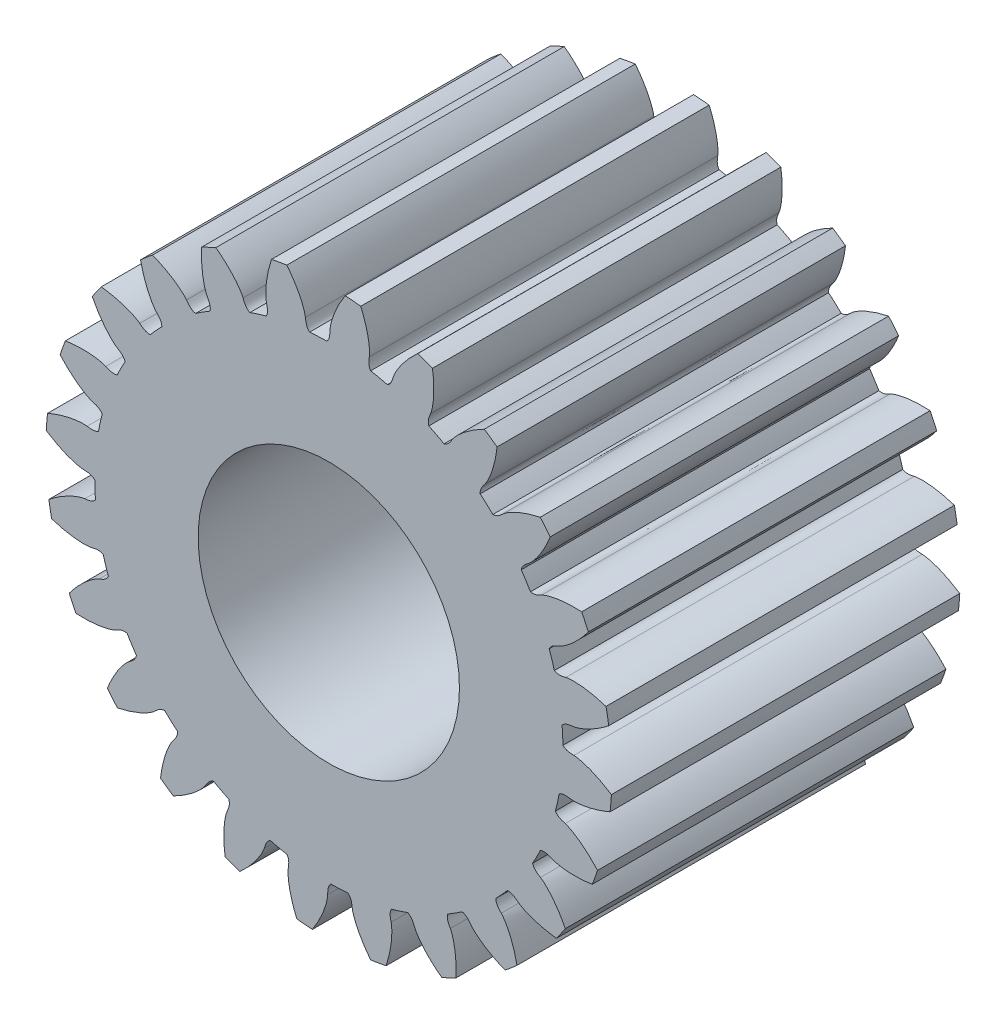
from build123d import *

# Parameters (mm, degrees)
EXTRUDE_1_DEPTH     = 8
SKETCH_4_R          = 3
CUT_EXTRUDE_1_DEPTH = 13.174471066


with BuildPart() as part:
    # 草图3 → 凸台-拉伸1 (new body)
    with BuildSketch(Plane.XY):
        with BuildLine():
            ThreePointArc((1.345300657, 5.203920747), (1.153835674, 5.249694109), (0.96082293, 5.288425503))
            add(Edge.make_bspline(
                [(0.930760994, 5.550248175), (0.917226783, 5.459893705), (0.905381381, 5.370037023), (0.96082293, 5.288425503)],
                knots=[0, 0, 0, 0, 1, 1, 1, 1], degree=3))
            add(Edge.make_bspline(
                [(0.930760994, 5.550248175), (0.931438306, 5.554769911), (0.933027207, 5.567494523), (0.934801806, 5.591702201), (0.935941865, 5.631320511), (0.934813459, 5.681900451), (0.930389457, 5.747252032), (0.921372989, 5.824078989), (0.907490474, 5.908178324), (0.888125137, 5.999148936), (0.865057443, 6.089311483), (0.838587684, 6.178580494), (0.809115965, 6.266822975), (0.779021032, 6.347910467), (0.755476896, 6.406477179), (0.739983442, 6.443220751), (0.733420318, 6.458490121)],
                knots=[0, 0, 0, 0, 0, 0.005376748, 0.015083688, 0.02853182, 0.046610139, 0.064854849, 0.092110525, 0.119476175, 0.146842495, 0.174208853, 0.201574955, 0.228941013, 0.256307345, 0.275859483, 0.275859483, 0.275859483, 0.275859483, 0.275859483], degree=4))
            ThreePointArc((0.733420318, 6.458490121), (0.55475765, 6.476283189), (0.3756717, 6.489134825))
            add(Edge.make_bspline(
                [(0.026739495, 5.627686544), (0.02684107, 5.632257597), (0.027439416, 5.64506706), (0.029807716, 5.669223882), (0.035422228, 5.708458911), (0.045136421, 5.758110074), (0.060610441, 5.821757192), (0.082561661, 5.895931459), (0.110544865, 5.976444581), (0.145099627, 6.062796402), (0.183165379, 6.147722263), (0.224431669, 6.231189009), (0.2684816, 6.313133632), (0.311928808, 6.387921517), (0.345090501, 6.441630818), (0.366607295, 6.475204102), (0.3756717, 6.489134825)],
                knots=[0, 0, 0, 0, 0, 0.005376748, 0.015083688, 0.02853182, 0.046610139, 0.064854849, 0.092110525, 0.119476175, 0.146842495, 0.174208853, 0.201574955, 0.228941013, 0.256307345, 0.275859491, 0.275859491, 0.275859491, 0.275859491, 0.275859491], degree=4))
            add(Edge.make_bspline(
                [(0.026739495, 5.627686544), (0.024709785, 5.5363466), (0.021100528, 5.44578441), (-0.04741315, 5.374790879)],
                knots=[0, 0, 0, 0, 1, 1, 1, 1], degree=3))
            ThreePointArc((-0.04741315, 5.374790879), (-0.244201139, 5.369449767), (-0.440661556, 5.356906047))
            add(Edge.make_bspline(
                [(-0.537463851, 5.602026727), (-0.527151437, 5.511248099), (-0.515336595, 5.421387393), (-0.440661556, 5.356906047)],
                knots=[0, 0, 0, 0, 1, 1, 1, 1], degree=3))
            add(Edge.make_bspline(
                [(-0.537463851, 5.602026727), (-0.537979929, 5.606569689), (-0.53973854, 5.619271959), (-0.544289818, 5.64311408), (-0.553442579, 5.681677498), (-0.567623586, 5.730241915), (-0.588811078, 5.792221679), (-0.617404597, 5.864097187), (-0.652580586, 5.941737847), (-0.694830993, 6.024596593), (-0.740448458, 6.105716567), (-0.789120802, 6.185092933), (-0.840427131, 6.262700782), (-0.890483591, 6.333236142), (-0.928383661, 6.383713571), (-0.952859125, 6.415195136), (-0.963150619, 6.428245553)],
                knots=[0, 0, 0, 0, 0, 0.005376748, 0.015083688, 0.02853182, 0.046610139, 0.064854849, 0.092110525, 0.119476175, 0.146842495, 0.174208853, 0.201574955, 0.228941013, 0.256307345, 0.275859483, 0.275859483, 0.275859483, 0.275859483, 0.275859483], degree=4))
            ThreePointArc((-0.963150619, 6.428245553), (-1.140330689, 6.399191036), (-1.316640682, 6.365253908))
            add(Edge.make_bspline(
                [(-1.430724089, 5.442848465), (-1.43180905, 5.447290054), (-1.434546426, 5.459817908), (-1.438511069, 5.483764567), (-1.44324264, 5.523115837), (-1.446710116, 5.573589396), (-1.448236447, 5.639072763), (-1.44623091, 5.716400997), (-1.440039539, 5.801413287), (-1.429011698, 5.893766171), (-1.414223436, 5.985650395), (-1.395966044, 6.076953583), (-1.374625907, 6.167506972), (-1.352015655, 6.250991485), (-1.333884909, 6.311453565), (-1.321790688, 6.349451822), (-1.316640682, 6.365253908)],
                knots=[0, 0, 0, 0, 0, 0.005376748, 0.015083688, 0.02853182, 0.046610139, 0.064854849, 0.092110525, 0.119476175, 0.146842495, 0.174208853, 0.201574955, 0.228941013, 0.256307345, 0.275859491, 0.275859491, 0.275859491, 0.275859491, 0.275859491], degree=4))
            add(Edge.make_bspline(
                [(-1.430724089, 5.442848465), (-1.409044121, 5.354095527), (-1.389091176, 5.265685024), (-1.436895829, 5.179377895)],
                knots=[0, 0, 0, 0, 1, 1, 1, 1], degree=3))
            ThreePointArc((-1.436895829, 5.179377895), (-1.625596049, 5.123286298), (-1.812115686, 5.060322296))
            add(Edge.make_bspline(
                [(-1.969061422, 5.272036414), (-1.935605158, 5.187020042), (-1.900935235, 5.103279172), (-1.812115686, 5.060322296)],
                knots=[0, 0, 0, 0, 1, 1, 1, 1], degree=3))
            add(Edge.make_bspline(
                [(-1.969061422, 5.272036414), (-1.970735721, 5.276291008), (-1.975721998, 5.288105296), (-1.986288989, 5.30995706), (-2.005110825, 5.344837552), (-2.031378022, 5.388076862), (-2.067885111, 5.44246099), (-2.11410708, 5.504486852), (-2.168179358, 5.570377756), (-2.230435538, 5.639477948), (-2.29549402, 5.706027157), (-2.36305201, 5.770101509), (-2.432696507, 5.83178588), (-2.49930323, 5.886962241), (-2.548976406, 5.925910433), (-2.580765916, 5.949984573), (-2.594084433, 5.959926674)],
                knots=[0, 0, 0, 0, 0, 0.005376748, 0.015083688, 0.02853182, 0.046610139, 0.064854849, 0.092110525, 0.119476175, 0.146842495, 0.174208853, 0.201574955, 0.228941013, 0.256307345, 0.275859483, 0.275859483, 0.275859483, 0.275859483, 0.275859483], degree=4))
            ThreePointArc((-2.594084433, 5.959926674), (-2.757707377, 5.886004589), (-2.919226177, 5.807591457))
            add(Edge.make_bspline(
                [(-2.79068619, 4.887089259), (-2.79288375, 4.891098695), (-2.798770299, 4.902491188), (-2.808797701, 4.924595759), (-2.823552906, 4.961381547), (-2.83996575, 5.009237812), (-2.858388415, 5.072094843), (-2.876465234, 5.147307253), (-2.892487629, 5.231025264), (-2.905738238, 5.323085515), (-2.91523526, 5.415666344), (-2.921230978, 5.508583812), (-2.92405493, 5.601574903), (-2.923822486, 5.688066715), (-2.921958268, 5.751161181), (-2.92011082, 5.790994894), (-2.919226177, 5.807591457)],
                knots=[0, 0, 0, 0, 0, 0.005376748, 0.015083688, 0.02853182, 0.046610139, 0.064854849, 0.092110525, 0.119476175, 0.146842495, 0.174208853, 0.201574955, 0.228941013, 0.256307345, 0.275859491, 0.275859491, 0.275859491, 0.275859491, 0.275859491], degree=4))
            add(Edge.make_bspline(
                [(-2.79068619, 4.887089259), (-2.746773999, 4.806971692), (-2.704618611, 4.726737907), (-2.728456432, 4.630998866)],
                knots=[0, 0, 0, 0, 1, 1, 1, 1], degree=3))
            ThreePointArc((-2.728456432, 4.630998866), (-2.896209274, 4.527979333), (-3.060077126, 4.418885944))
            add(Edge.make_bspline(
                [(-3.266470712, 4.582765533), (-3.212150585, 4.509305142), (-3.15698828, 4.437390908), (-3.060077126, 4.418885944)],
                knots=[0, 0, 0, 0, 1, 1, 1, 1], degree=3))
            add(Edge.make_bspline(
                [(-3.266470712, 4.582765533), (-3.26918913, 4.586441815), (-3.277063266, 4.596562997), (-3.292925849, 4.614935241), (-3.320134081, 4.64375576), (-3.356697403, 4.678723275), (-3.406036191, 4.721805579), (-3.466736659, 4.769754836), (-3.53602029, 4.819405625), (-3.614039588, 4.870038201), (-3.694105458, 4.917481427), (-3.775945128, 4.961887203), (-3.859181637, 5.003444408), (-3.937799483, 5.039501592), (-3.99586062, 5.064266293), (-4.032797776, 5.079292395), (-4.04823568, 5.085448641)],
                knots=[0, 0, 0, 0, 0, 0.005376748, 0.015083688, 0.02853182, 0.046610139, 0.064854849, 0.092110525, 0.119476175, 0.146842495, 0.174208853, 0.201574955, 0.228941013, 0.256307345, 0.275859483, 0.275859483, 0.275859483, 0.275859483, 0.275859483], degree=4))
            ThreePointArc((-4.04823568, 5.085448641), (-4.187150864, 4.971696656), (-4.322871232, 4.854151245))
            add(Edge.make_bspline(
                [(-3.96046764, 3.998282996), (-3.963628038, 4.001587043), (-3.972262602, 4.011067795), (-3.987669413, 4.029823889), (-4.011442708, 4.061537303), (-4.039682411, 4.103514949), (-4.073745935, 4.159462043), (-4.110673206, 4.227433027), (-4.147817467, 4.304151514), (-4.184443518, 4.389645379), (-4.21757862, 4.476613582), (-4.247418848, 4.564813159), (-4.274214442, 4.653904762), (-4.296375647, 4.737509598), (-4.310905, 4.798936667), (-4.319430226, 4.837891234), (-4.322871232, 4.854151245)],
                knots=[0, 0, 0, 0, 0, 0.005376748, 0.015083688, 0.02853182, 0.046610139, 0.064854849, 0.092110525, 0.119476175, 0.146842495, 0.174208853, 0.201574955, 0.228941013, 0.256307345, 0.275859491, 0.275859491, 0.275859491, 0.275859491, 0.275859491], degree=4))
            add(Edge.make_bspline(
                [(-3.96046764, 3.998282996), (-3.897315767, 3.93226068), (-3.835830758, 3.865671412), (-3.834077238, 3.767024918)],
                knots=[0, 0, 0, 0, 1, 1, 1, 1], degree=3))
            ThreePointArc((-3.834077238, 3.767024918), (-3.969450623, 3.62409806), (-4.099499366, 3.476309817))
            add(Edge.make_bspline(
                [(-4.34127542, 3.581186753), (-4.269793259, 3.524288548), (-4.19789779, 3.469101788), (-4.099499366, 3.476309817)],
                knots=[0, 0, 0, 0, 1, 1, 1, 1], degree=3))
            add(Edge.make_bspline(
                [(-4.34127542, 3.581186753), (-4.344852702, 3.584034191), (-4.355078089, 3.591772526), (-4.375155254, 3.605413212), (-4.408895687, 3.626209687), (-4.453263403, 3.650522429), (-4.512071533, 3.679366921), (-4.583113863, 3.709971909), (-4.662887282, 3.739998966), (-4.751352812, 3.768713398), (-4.840969714, 3.793817463), (-4.931513825, 3.815528484), (-5.022669915, 3.834126468), (-5.107941209, 3.848607237), (-5.170433538, 3.857500773), (-5.210001131, 3.862454835), (-5.226506355, 3.864405687)],
                knots=[0, 0, 0, 0, 0, 0.005376748, 0.015083688, 0.02853182, 0.046610139, 0.064854849, 0.092110525, 0.119476175, 0.146842495, 0.174208853, 0.201574955, 0.228941013, 0.256307345, 0.275859483, 0.275859483, 0.275859483, 0.275859483, 0.275859483], degree=4))
            ThreePointArc((-5.226506355, 3.864405687), (-5.331246939, 3.718575813), (-5.431919757, 3.569908648))
            add(Edge.make_bspline(
                [(-4.860349764, 2.837000354), (-4.864257625, 2.839373847), (-4.875051772, 2.846296761), (-4.894788043, 2.86042618), (-4.925959319, 2.884906004), (-4.964101391, 2.918144324), (-5.011484403, 2.963368777), (-5.064745592, 3.019466225), (-5.120480399, 3.083956952), (-5.177985888, 3.157058164), (-5.232500966, 3.232487002), (-5.284152144, 3.309958031), (-5.333093303, 3.389078702), (-5.376137907, 3.46409903), (-5.40607068, 3.51967255), (-5.424387599, 3.555093281), (-5.431919757, 3.569908648)],
                knots=[0, 0, 0, 0, 0, 0.005376748, 0.015083688, 0.02853182, 0.046610139, 0.064854849, 0.092110525, 0.119476175, 0.146842495, 0.174208853, 0.201574955, 0.228941013, 0.256307345, 0.275859491, 0.275859491, 0.275859491, 0.275859491, 0.275859491], degree=4))
            add(Edge.make_bspline(
                [(-4.860349764, 2.837000354), (-4.782261907, 2.789572601), (-4.705637378, 2.741165798), (-4.678412016, 2.646334447)],
                knots=[0, 0, 0, 0, 1, 1, 1, 1], degree=3))
            ThreePointArc((-4.678412016, 2.646334447), (-4.772180472, 2.473240493), (-4.8595475, 2.296828921))
            add(Edge.make_bspline(
                [(-5.120229383, 2.335556015), (-5.036456579, 2.299097513), (-4.952727504, 2.264399113), (-4.8595475, 2.296828921)],
                knots=[0, 0, 0, 0, 1, 1, 1, 1], degree=3))
            add(Edge.make_bspline(
                [(-5.120229383, 2.335556015), (-5.124421743, 2.337380559), (-5.136301537, 2.342208692), (-5.159225058, 2.350188231), (-5.197198338, 2.361543416), (-5.246346861, 2.373544512), (-5.310616657, 2.386185488), (-5.387159432, 2.397360528), (-5.471986212, 2.405717558), (-5.564869194, 2.410557006), (-5.657929884, 2.411611109), (-5.751008006, 2.409147805), (-5.843871539, 2.403519145), (-5.929985183, 2.395436659), (-5.992649954, 2.387852951), (-6.03215152, 2.38239736), (-6.04859926, 2.380009873)],
                knots=[0, 0, 0, 0, 0, 0.005376748, 0.015083688, 0.02853182, 0.046610139, 0.064854849, 0.092110525, 0.119476175, 0.146842495, 0.174208853, 0.201574955, 0.228941013, 0.256307345, 0.275859483, 0.275859483, 0.275859483, 0.275859483, 0.275859483], degree=4))
            ThreePointArc((-6.04859926, 2.380009873), (-6.112027346, 2.212040172), (-6.170791927, 2.042382676))
            add(Edge.make_bspline(
                [(-5.429007085, 1.482380826), (-5.433396093, 1.483662016), (-5.445614221, 1.487555306), (-5.468334958, 1.496095154), (-5.504779943, 1.511673129), (-5.550225066, 1.533906986), (-5.60769849, 1.565326827), (-5.673663936, 1.605727791), (-5.744191054, 1.65359582), (-5.818657077, 1.709322653), (-5.890837018, 1.768071775), (-5.960779203, 1.829534735), (-6.028530669, 1.89329253), (-6.089525253, 1.954615839), (-6.132821577, 2.000548565), (-6.159681922, 2.030021597), (-6.170791927, 2.042382676)],
                knots=[0, 0, 0, 0, 0, 0.005376748, 0.015083688, 0.02853182, 0.046610139, 0.064854849, 0.092110525, 0.119476175, 0.146842495, 0.174208853, 0.201574955, 0.228941013, 0.256307345, 0.275859491, 0.275859491, 0.275859491, 0.275859491, 0.275859491], degree=4))
            add(Edge.make_bspline(
                [(-5.429007085, 1.482380826), (-5.341304801, 1.45677976), (-5.254762587, 1.429854266), (-5.203920747, 1.345300657)],
                knots=[0, 0, 0, 0, 1, 1, 1, 1], degree=3))
            ThreePointArc((-5.203920747, 1.345300657), (-5.249694109, 1.153835674), (-5.288425503, 0.96082293))
            add(Edge.make_bspline(
                [(-5.550248175, 0.930760994), (-5.459893705, 0.917226783), (-5.370037023, 0.905381382), (-5.288425503, 0.96082293)],
                knots=[0, 0, 0, 0, 1, 1, 1, 1], degree=3))
            add(Edge.make_bspline(
                [(-5.550248175, 0.930760994), (-5.554769911, 0.931438306), (-5.567494523, 0.933027207), (-5.591702201, 0.934801806), (-5.631320511, 0.935941865), (-5.681900451, 0.934813459), (-5.747252032, 0.930389457), (-5.824078989, 0.921372989), (-5.908178324, 0.907490474), (-5.999148936, 0.888125137), (-6.089311483, 0.865057443), (-6.178580494, 0.838587684), (-6.266822975, 0.809115965), (-6.347910467, 0.779021032), (-6.406477179, 0.755476896), (-6.443220751, 0.739983442), (-6.458490121, 0.733420318)],
                knots=[0, 0, 0, 0, 0, 0.005376748, 0.015083688, 0.02853182, 0.046610139, 0.064854849, 0.092110525, 0.119476175, 0.146842495, 0.174208853, 0.201574955, 0.228941013, 0.256307345, 0.275859483, 0.275859483, 0.275859483, 0.275859483, 0.275859483], degree=4))
            ThreePointArc((-6.458490121, 0.733420318), (-6.476283189, 0.55475765), (-6.489134825, 0.3756717))
            add(Edge.make_bspline(
                [(-5.627686544, 0.026739495), (-5.632257597, 0.02684107), (-5.64506706, 0.027439416), (-5.669223882, 0.029807716), (-5.708458911, 0.035422228), (-5.758110074, 0.045136421), (-5.821757192, 0.060610441), (-5.895931459, 0.082561661), (-5.976444581, 0.110544865), (-6.062796402, 0.145099627), (-6.147722263, 0.183165379), (-6.231189009, 0.224431669), (-6.313133632, 0.2684816), (-6.387921517, 0.311928808), (-6.441630818, 0.345090501), (-6.475204102, 0.366607295), (-6.489134825, 0.3756717)],
                knots=[0, 0, 0, 0, 0, 0.005376748, 0.015083688, 0.02853182, 0.046610139, 0.064854849, 0.092110525, 0.119476175, 0.146842495, 0.174208853, 0.201574955, 0.228941013, 0.256307345, 0.275859491, 0.275859491, 0.275859491, 0.275859491, 0.275859491], degree=4))
            add(Edge.make_bspline(
                [(-5.627686544, 0.026739495), (-5.5363466, 0.024709785), (-5.44578441, 0.021100528), (-5.374790879, -0.04741315)],
                knots=[0, 0, 0, 0, 1, 1, 1, 1], degree=3))
            ThreePointArc((-5.374790879, -0.04741315), (-5.369449767, -0.244201139), (-5.356906047, -0.440661556))
            add(Edge.make_bspline(
                [(-5.602026727, -0.537463851), (-5.511248099, -0.527151437), (-5.421387393, -0.515336595), (-5.356906047, -0.440661556)],
                knots=[0, 0, 0, 0, 1, 1, 1, 1], degree=3))
            add(Edge.make_bspline(
                [(-5.602026727, -0.537463851), (-5.606569689, -0.537979929), (-5.619271959, -0.53973854), (-5.64311408, -0.544289818), (-5.681677498, -0.553442579), (-5.730241915, -0.567623586), (-5.792221679, -0.588811078), (-5.864097187, -0.617404597), (-5.941737847, -0.652580586), (-6.024596593, -0.694830993), (-6.105716567, -0.740448458), (-6.185092933, -0.789120802), (-6.262700782, -0.840427131), (-6.333236142, -0.890483591), (-6.383713571, -0.928383661), (-6.415195136, -0.952859125), (-6.428245553, -0.963150619)],
                knots=[0, 0, 0, 0, 0, 0.005376748, 0.015083688, 0.02853182, 0.046610139, 0.064854849, 0.092110525, 0.119476175, 0.146842495, 0.174208853, 0.201574955, 0.228941013, 0.256307345, 0.275859483, 0.275859483, 0.275859483, 0.275859483, 0.275859483], degree=4))
            ThreePointArc((-6.428245553, -0.963150619), (-6.399191036, -1.140330689), (-6.365253908, -1.316640682))
            add(Edge.make_bspline(
                [(-5.442848465, -1.430724089), (-5.447290054, -1.43180905), (-5.459817908, -1.434546426), (-5.483764567, -1.438511069), (-5.523115837, -1.44324264), (-5.573589396, -1.446710116), (-5.639072763, -1.448236447), (-5.716400997, -1.44623091), (-5.801413287, -1.440039539), (-5.893766171, -1.429011698), (-5.985650395, -1.414223436), (-6.076953583, -1.395966044), (-6.167506972, -1.374625907), (-6.250991485, -1.352015655), (-6.311453565, -1.333884909), (-6.349451822, -1.321790688), (-6.365253908, -1.316640682)],
                knots=[0, 0, 0, 0, 0, 0.005376748, 0.015083688, 0.02853182, 0.046610139, 0.064854849, 0.092110525, 0.119476175, 0.146842495, 0.174208853, 0.201574955, 0.228941013, 0.256307345, 0.275859491, 0.275859491, 0.275859491, 0.275859491, 0.275859491], degree=4))
            add(Edge.make_bspline(
                [(-5.442848465, -1.430724089), (-5.354095527, -1.409044121), (-5.265685024, -1.389091176), (-5.179377895, -1.436895829)],
                knots=[0, 0, 0, 0, 1, 1, 1, 1], degree=3))
            ThreePointArc((-5.179377895, -1.436895829), (-5.123286298, -1.625596049), (-5.060322296, -1.812115686))
            add(Edge.make_bspline(
                [(-5.272036414, -1.969061422), (-5.187020042, -1.935605158), (-5.103279172, -1.900935235), (-5.060322296, -1.812115686)],
                knots=[0, 0, 0, 0, 1, 1, 1, 1], degree=3))
            add(Edge.make_bspline(
                [(-5.272036414, -1.969061422), (-5.276291008, -1.970735721), (-5.288105296, -1.975721998), (-5.30995706, -1.986288989), (-5.344837552, -2.005110825), (-5.388076862, -2.031378022), (-5.44246099, -2.067885111), (-5.504486852, -2.11410708), (-5.570377756, -2.168179358), (-5.639477948, -2.230435538), (-5.706027157, -2.29549402), (-5.770101509, -2.36305201), (-5.83178588, -2.432696507), (-5.886962241, -2.49930323), (-5.925910433, -2.548976406), (-5.949984573, -2.580765916), (-5.959926674, -2.594084433)],
                knots=[0, 0, 0, 0, 0, 0.005376748, 0.015083688, 0.02853182, 0.046610139, 0.064854849, 0.092110525, 0.119476175, 0.146842495, 0.174208853, 0.201574955, 0.228941013, 0.256307345, 0.275859483, 0.275859483, 0.275859483, 0.275859483, 0.275859483], degree=4))
            ThreePointArc((-5.959926674, -2.594084433), (-5.886004589, -2.757707377), (-5.807591457, -2.919226177))
            add(Edge.make_bspline(
                [(-4.887089259, -2.79068619), (-4.891098695, -2.79288375), (-4.902491188, -2.798770299), (-4.924595759, -2.808797701), (-4.961381547, -2.823552906), (-5.009237812, -2.83996575), (-5.072094843, -2.858388415), (-5.147307253, -2.876465234), (-5.231025264, -2.892487629), (-5.323085515, -2.905738238), (-5.415666344, -2.91523526), (-5.508583812, -2.921230978), (-5.601574903, -2.92405493), (-5.688066715, -2.923822486), (-5.751161181, -2.921958268), (-5.790994894, -2.92011082), (-5.807591457, -2.919226177)],
                knots=[0, 0, 0, 0, 0, 0.005376748, 0.015083688, 0.02853182, 0.046610139, 0.064854849, 0.092110525, 0.119476175, 0.146842495, 0.174208853, 0.201574955, 0.228941013, 0.256307345, 0.275859491, 0.275859491, 0.275859491, 0.275859491, 0.275859491], degree=4))
            add(Edge.make_bspline(
                [(-4.887089259, -2.79068619), (-4.806971692, -2.746773999), (-4.726737907, -2.704618611), (-4.630998866, -2.728456432)],
                knots=[0, 0, 0, 0, 1, 1, 1, 1], degree=3))
            ThreePointArc((-4.630998866, -2.728456432), (-4.527979333, -2.896209274), (-4.418885944, -3.060077126))
            add(Edge.make_bspline(
                [(-4.582765533, -3.266470712), (-4.509305142, -3.212150586), (-4.437390908, -3.15698828), (-4.418885944, -3.060077126)],
                knots=[0, 0, 0, 0, 1, 1, 1, 1], degree=3))
            add(Edge.make_bspline(
                [(-4.582765533, -3.266470712), (-4.586441815, -3.26918913), (-4.596562997, -3.277063266), (-4.614935241, -3.292925849), (-4.64375576, -3.320134081), (-4.678723275, -3.356697403), (-4.721805579, -3.406036191), (-4.769754836, -3.466736659), (-4.819405625, -3.53602029), (-4.870038201, -3.614039588), (-4.917481427, -3.694105458), (-4.961887203, -3.775945128), (-5.003444408, -3.859181637), (-5.039501592, -3.937799483), (-5.064266293, -3.99586062), (-5.079292395, -4.032797776), (-5.085448641, -4.04823568)],
                knots=[0, 0, 0, 0, 0, 0.005376748, 0.015083688, 0.02853182, 0.046610139, 0.064854849, 0.092110525, 0.119476175, 0.146842495, 0.174208853, 0.201574955, 0.228941013, 0.256307345, 0.275859483, 0.275859483, 0.275859483, 0.275859483, 0.275859483], degree=4))
            ThreePointArc((-5.085448641, -4.04823568), (-4.971696656, -4.187150864), (-4.854151245, -4.322871232))
            add(Edge.make_bspline(
                [(-3.998282996, -3.96046764), (-4.001587043, -3.963628038), (-4.011067795, -3.972262602), (-4.029823889, -3.987669413), (-4.061537303, -4.011442708), (-4.103514949, -4.039682411), (-4.159462043, -4.073745935), (-4.227433027, -4.110673206), (-4.304151514, -4.147817467), (-4.389645379, -4.184443518), (-4.476613582, -4.21757862), (-4.564813159, -4.247418848), (-4.653904762, -4.274214442), (-4.737509598, -4.296375647), (-4.798936667, -4.310905), (-4.837891234, -4.319430226), (-4.854151245, -4.322871232)],
                knots=[0, 0, 0, 0, 0, 0.005376748, 0.015083688, 0.02853182, 0.046610139, 0.064854849, 0.092110525, 0.119476175, 0.146842495, 0.174208853, 0.201574955, 0.228941013, 0.256307345, 0.275859491, 0.275859491, 0.275859491, 0.275859491, 0.275859491], degree=4))
            add(Edge.make_bspline(
                [(-3.998282996, -3.96046764), (-3.93226068, -3.897315767), (-3.865671412, -3.835830758), (-3.767024918, -3.834077238)],
                knots=[0, 0, 0, 0, 1, 1, 1, 1], degree=3))
            ThreePointArc((-3.767024918, -3.834077238), (-3.62409806, -3.969450623), (-3.476309817, -4.099499366))
            add(Edge.make_bspline(
                [(-3.581186753, -4.34127542), (-3.524288548, -4.269793259), (-3.469101788, -4.19789779), (-3.476309817, -4.099499366)],
                knots=[0, 0, 0, 0, 1, 1, 1, 1], degree=3))
            add(Edge.make_bspline(
                [(-3.581186753, -4.34127542), (-3.584034191, -4.344852702), (-3.591772526, -4.355078089), (-3.605413212, -4.375155254), (-3.626209687, -4.408895687), (-3.650522429, -4.453263403), (-3.679366921, -4.512071533), (-3.709971909, -4.583113863), (-3.739998966, -4.662887282), (-3.768713398, -4.751352812), (-3.793817463, -4.840969714), (-3.815528484, -4.931513825), (-3.834126468, -5.022669915), (-3.848607237, -5.107941209), (-3.857500773, -5.170433538), (-3.862454835, -5.210001131), (-3.864405687, -5.226506355)],
                knots=[0, 0, 0, 0, 0, 0.005376748, 0.015083688, 0.02853182, 0.046610139, 0.064854849, 0.092110525, 0.119476175, 0.146842495, 0.174208853, 0.201574955, 0.228941013, 0.256307345, 0.275859483, 0.275859483, 0.275859483, 0.275859483, 0.275859483], degree=4))
            ThreePointArc((-3.864405687, -5.226506355), (-3.718575813, -5.331246939), (-3.569908648, -5.431919757))
            add(Edge.make_bspline(
                [(-2.837000354, -4.860349764), (-2.839373847, -4.864257625), (-2.846296761, -4.875051772), (-2.86042618, -4.894788043), (-2.884906004, -4.925959319), (-2.918144324, -4.964101391), (-2.963368777, -5.011484403), (-3.019466225, -5.064745592), (-3.083956952, -5.120480399), (-3.157058164, -5.177985888), (-3.232487002, -5.232500966), (-3.309958031, -5.284152144), (-3.389078702, -5.333093303), (-3.46409903, -5.376137907), (-3.51967255, -5.40607068), (-3.555093281, -5.424387599), (-3.569908648, -5.431919757)],
                knots=[0, 0, 0, 0, 0, 0.005376748, 0.015083688, 0.02853182, 0.046610139, 0.064854849, 0.092110525, 0.119476175, 0.146842495, 0.174208853, 0.201574955, 0.228941013, 0.256307345, 0.275859491, 0.275859491, 0.275859491, 0.275859491, 0.275859491], degree=4))
            add(Edge.make_bspline(
                [(-2.837000354, -4.860349764), (-2.789572601, -4.782261907), (-2.741165798, -4.705637378), (-2.646334447, -4.678412016)],
                knots=[0, 0, 0, 0, 1, 1, 1, 1], degree=3))
            ThreePointArc((-2.646334447, -4.678412016), (-2.473240493, -4.772180472), (-2.296828921, -4.8595475))
            add(Edge.make_bspline(
                [(-2.335556015, -5.120229383), (-2.299097513, -5.036456579), (-2.264399113, -4.952727504), (-2.296828921, -4.8595475)],
                knots=[0, 0, 0, 0, 1, 1, 1, 1], degree=3))
            add(Edge.make_bspline(
                [(-2.335556015, -5.120229383), (-2.337380559, -5.124421743), (-2.342208692, -5.136301537), (-2.350188231, -5.159225058), (-2.361543416, -5.197198338), (-2.373544512, -5.246346861), (-2.386185488, -5.310616657), (-2.397360528, -5.387159432), (-2.405717558, -5.471986212), (-2.410557006, -5.564869194), (-2.411611109, -5.657929884), (-2.409147805, -5.751008006), (-2.403519145, -5.843871539), (-2.395436659, -5.929985183), (-2.387852951, -5.992649954), (-2.38239736, -6.03215152), (-2.380009873, -6.04859926)],
                knots=[0, 0, 0, 0, 0, 0.005376748, 0.015083688, 0.02853182, 0.046610139, 0.064854849, 0.092110525, 0.119476175, 0.146842495, 0.174208853, 0.201574955, 0.228941013, 0.256307345, 0.275859483, 0.275859483, 0.275859483, 0.275859483, 0.275859483], degree=4))
            ThreePointArc((-2.380009873, -6.04859926), (-2.212040172, -6.112027346), (-2.042382676, -6.170791927))
            add(Edge.make_bspline(
                [(-1.482380826, -5.429007085), (-1.483662016, -5.433396093), (-1.487555306, -5.445614221), (-1.496095154, -5.468334958), (-1.511673129, -5.504779943), (-1.533906986, -5.550225066), (-1.565326827, -5.60769849), (-1.605727791, -5.673663936), (-1.65359582, -5.744191054), (-1.709322653, -5.818657077), (-1.768071775, -5.890837018), (-1.829534735, -5.960779203), (-1.89329253, -6.028530669), (-1.954615839, -6.089525253), (-2.000548565, -6.132821577), (-2.030021597, -6.159681922), (-2.042382676, -6.170791927)],
                knots=[0, 0, 0, 0, 0, 0.005376748, 0.015083688, 0.02853182, 0.046610139, 0.064854849, 0.092110525, 0.119476175, 0.146842495, 0.174208853, 0.201574955, 0.228941013, 0.256307345, 0.275859491, 0.275859491, 0.275859491, 0.275859491, 0.275859491], degree=4))
            add(Edge.make_bspline(
                [(-1.482380826, -5.429007085), (-1.45677976, -5.341304801), (-1.429854266, -5.254762587), (-1.345300657, -5.203920747)],
                knots=[0, 0, 0, 0, 1, 1, 1, 1], degree=3))
            ThreePointArc((-1.345300657, -5.203920747), (-1.153835674, -5.249694109), (-0.96082293, -5.288425503))
            add(Edge.make_bspline(
                [(-0.930760994, -5.550248175), (-0.917226783, -5.459893705), (-0.905381382, -5.370037023), (-0.96082293, -5.288425503)],
                knots=[0, 0, 0, 0, 1, 1, 1, 1], degree=3))
            add(Edge.make_bspline(
                [(-0.930760994, -5.550248175), (-0.931438306, -5.554769911), (-0.933027207, -5.567494523), (-0.934801806, -5.591702201), (-0.935941865, -5.631320511), (-0.934813459, -5.681900451), (-0.930389457, -5.747252032), (-0.921372989, -5.824078989), (-0.907490474, -5.908178324), (-0.888125137, -5.999148936), (-0.865057443, -6.089311483), (-0.838587684, -6.178580494), (-0.809115965, -6.266822975), (-0.779021032, -6.347910467), (-0.755476896, -6.406477179), (-0.739983442, -6.443220751), (-0.733420318, -6.458490121)],
                knots=[0, 0, 0, 0, 0, 0.005376748, 0.015083688, 0.02853182, 0.046610139, 0.064854849, 0.092110525, 0.119476175, 0.146842495, 0.174208853, 0.201574955, 0.228941013, 0.256307345, 0.275859483, 0.275859483, 0.275859483, 0.275859483, 0.275859483], degree=4))
            ThreePointArc((-0.733420318, -6.458490121), (-0.55475765, -6.476283189), (-0.3756717, -6.489134825))
            add(Edge.make_bspline(
                [(-0.026739495, -5.627686544), (-0.02684107, -5.632257597), (-0.027439416, -5.64506706), (-0.029807716, -5.669223882), (-0.035422228, -5.708458911), (-0.045136421, -5.758110074), (-0.060610441, -5.821757192), (-0.082561661, -5.895931459), (-0.110544865, -5.976444581), (-0.145099627, -6.062796402), (-0.183165379, -6.147722263), (-0.224431669, -6.231189009), (-0.2684816, -6.313133632), (-0.311928808, -6.387921517), (-0.345090501, -6.441630818), (-0.366607295, -6.475204102), (-0.3756717, -6.489134825)],
                knots=[0, 0, 0, 0, 0, 0.005376748, 0.015083688, 0.02853182, 0.046610139, 0.064854849, 0.092110525, 0.119476175, 0.146842495, 0.174208853, 0.201574955, 0.228941013, 0.256307345, 0.275859491, 0.275859491, 0.275859491, 0.275859491, 0.275859491], degree=4))
            add(Edge.make_bspline(
                [(-0.026739495, -5.627686544), (-0.024709785, -5.5363466), (-0.021100528, -5.44578441), (0.04741315, -5.374790879)],
                knots=[0, 0, 0, 0, 1, 1, 1, 1], degree=3))
            ThreePointArc((0.04741315, -5.374790879), (0.244201139, -5.369449767), (0.440661556, -5.356906047))
            add(Edge.make_bspline(
                [(0.537463851, -5.602026727), (0.527151437, -5.511248099), (0.515336595, -5.421387393), (0.440661556, -5.356906047)],
                knots=[0, 0, 0, 0, 1, 1, 1, 1], degree=3))
            add(Edge.make_bspline(
                [(0.537463851, -5.602026727), (0.537979929, -5.606569689), (0.53973854, -5.619271959), (0.544289818, -5.64311408), (0.553442579, -5.681677498), (0.567623586, -5.730241915), (0.588811078, -5.792221679), (0.617404597, -5.864097187), (0.652580586, -5.941737847), (0.694830993, -6.024596593), (0.740448458, -6.105716567), (0.789120802, -6.185092933), (0.840427131, -6.262700782), (0.890483591, -6.333236142), (0.928383661, -6.383713571), (0.952859125, -6.415195136), (0.963150619, -6.428245553)],
                knots=[0, 0, 0, 0, 0, 0.005376748, 0.015083688, 0.02853182, 0.046610139, 0.064854849, 0.092110525, 0.119476175, 0.146842495, 0.174208853, 0.201574955, 0.228941013, 0.256307345, 0.275859483, 0.275859483, 0.275859483, 0.275859483, 0.275859483], degree=4))
            ThreePointArc((0.963150619, -6.428245553), (1.140330689, -6.399191036), (1.316640682, -6.365253908))
            add(Edge.make_bspline(
                [(1.430724089, -5.442848465), (1.43180905, -5.447290054), (1.434546426, -5.459817908), (1.438511069, -5.483764567), (1.44324264, -5.523115837), (1.446710116, -5.573589396), (1.448236447, -5.639072763), (1.44623091, -5.716400997), (1.440039539, -5.801413286), (1.429011698, -5.893766171), (1.414223436, -5.985650395), (1.395966044, -6.076953583), (1.374625907, -6.167506972), (1.352015655, -6.250991485), (1.333884909, -6.311453565), (1.321790688, -6.349451822), (1.316640682, -6.365253908)],
                knots=[0, 0, 0, 0, 0, 0.005376748, 0.015083688, 0.02853182, 0.046610139, 0.064854849, 0.092110525, 0.119476175, 0.146842495, 0.174208853, 0.201574955, 0.228941013, 0.256307345, 0.275859491, 0.275859491, 0.275859491, 0.275859491, 0.275859491], degree=4))
            add(Edge.make_bspline(
                [(1.430724089, -5.442848465), (1.409044121, -5.354095527), (1.389091176, -5.265685024), (1.436895829, -5.179377895)],
                knots=[0, 0, 0, 0, 1, 1, 1, 1], degree=3))
            ThreePointArc((1.436895829, -5.179377895), (1.625596049, -5.123286298), (1.812115686, -5.060322296))
            add(Edge.make_bspline(
                [(1.969061422, -5.272036414), (1.935605158, -5.187020042), (1.900935235, -5.103279172), (1.812115686, -5.060322296)],
                knots=[0, 0, 0, 0, 1, 1, 1, 1], degree=3))
            add(Edge.make_bspline(
                [(1.969061422, -5.272036414), (1.970735721, -5.276291008), (1.975721998, -5.288105296), (1.986288989, -5.30995706), (2.005110825, -5.344837552), (2.031378022, -5.388076862), (2.067885111, -5.44246099), (2.11410708, -5.504486852), (2.168179358, -5.570377756), (2.230435538, -5.639477948), (2.29549402, -5.706027157), (2.36305201, -5.770101509), (2.432696507, -5.83178588), (2.49930323, -5.886962241), (2.548976406, -5.925910433), (2.580765916, -5.949984573), (2.594084433, -5.959926674)],
                knots=[0, 0, 0, 0, 0, 0.005376748, 0.015083688, 0.02853182, 0.046610139, 0.064854849, 0.092110525, 0.119476175, 0.146842495, 0.174208853, 0.201574955, 0.228941013, 0.256307345, 0.275859483, 0.275859483, 0.275859483, 0.275859483, 0.275859483], degree=4))
            ThreePointArc((2.594084433, -5.959926674), (2.757707377, -5.886004589), (2.919226177, -5.807591457))
            add(Edge.make_bspline(
                [(2.79068619, -4.887089259), (2.79288375, -4.891098695), (2.798770299, -4.902491188), (2.808797701, -4.924595759), (2.823552906, -4.961381547), (2.83996575, -5.009237812), (2.858388415, -5.072094843), (2.876465234, -5.147307253), (2.892487629, -5.231025264), (2.905738238, -5.323085515), (2.91523526, -5.415666344), (2.921230978, -5.508583812), (2.92405493, -5.601574903), (2.923822486, -5.688066715), (2.921958268, -5.751161181), (2.92011082, -5.790994894), (2.919226177, -5.807591457)],
                knots=[0, 0, 0, 0, 0, 0.005376748, 0.015083688, 0.02853182, 0.046610139, 0.064854849, 0.092110525, 0.119476175, 0.146842495, 0.174208853, 0.201574955, 0.228941013, 0.256307345, 0.275859491, 0.275859491, 0.275859491, 0.275859491, 0.275859491], degree=4))
            add(Edge.make_bspline(
                [(2.79068619, -4.887089259), (2.746773999, -4.806971692), (2.704618611, -4.726737907), (2.728456432, -4.630998866)],
                knots=[0, 0, 0, 0, 1, 1, 1, 1], degree=3))
            ThreePointArc((2.728456432, -4.630998866), (2.896209274, -4.527979333), (3.060077126, -4.418885944))
            add(Edge.make_bspline(
                [(3.266470712, -4.582765533), (3.212150586, -4.509305142), (3.15698828, -4.437390908), (3.060077126, -4.418885944)],
                knots=[0, 0, 0, 0, 1, 1, 1, 1], degree=3))
            add(Edge.make_bspline(
                [(3.266470712, -4.582765533), (3.26918913, -4.586441815), (3.277063266, -4.596562997), (3.292925849, -4.614935241), (3.320134081, -4.64375576), (3.356697403, -4.678723275), (3.406036191, -4.721805579), (3.466736659, -4.769754836), (3.53602029, -4.819405625), (3.614039588, -4.870038201), (3.694105458, -4.917481427), (3.775945128, -4.961887203), (3.859181637, -5.003444408), (3.937799483, -5.039501592), (3.99586062, -5.064266293), (4.032797776, -5.079292395), (4.04823568, -5.085448641)],
                knots=[0, 0, 0, 0, 0, 0.005376748, 0.015083688, 0.02853182, 0.046610139, 0.064854849, 0.092110525, 0.119476175, 0.146842495, 0.174208853, 0.201574955, 0.228941013, 0.256307345, 0.275859483, 0.275859483, 0.275859483, 0.275859483, 0.275859483], degree=4))
            ThreePointArc((4.04823568, -5.085448641), (4.187150864, -4.971696656), (4.322871232, -4.854151245))
            add(Edge.make_bspline(
                [(3.96046764, -3.998282996), (3.963628038, -4.001587043), (3.972262602, -4.011067795), (3.987669413, -4.029823889), (4.011442708, -4.061537303), (4.039682411, -4.103514949), (4.073745935, -4.159462043), (4.110673206, -4.227433027), (4.147817467, -4.304151514), (4.184443518, -4.389645379), (4.21757862, -4.476613582), (4.247418848, -4.564813158), (4.274214442, -4.653904762), (4.296375647, -4.737509598), (4.310905, -4.798936667), (4.319430226, -4.837891234), (4.322871232, -4.854151245)],
                knots=[0, 0, 0, 0, 0, 0.005376748, 0.015083688, 0.02853182, 0.046610139, 0.064854849, 0.092110525, 0.119476175, 0.146842495, 0.174208853, 0.201574955, 0.228941013, 0.256307345, 0.275859491, 0.275859491, 0.275859491, 0.275859491, 0.275859491], degree=4))
            add(Edge.make_bspline(
                [(3.96046764, -3.998282996), (3.897315767, -3.93226068), (3.835830758, -3.865671412), (3.834077238, -3.767024918)],
                knots=[0, 0, 0, 0, 1, 1, 1, 1], degree=3))
            ThreePointArc((3.834077238, -3.767024918), (3.969450623, -3.62409806), (4.099499366, -3.476309817))
            add(Edge.make_bspline(
                [(4.34127542, -3.581186753), (4.269793259, -3.524288548), (4.19789779, -3.469101788), (4.099499366, -3.476309817)],
                knots=[0, 0, 0, 0, 1, 1, 1, 1], degree=3))
            add(Edge.make_bspline(
                [(4.34127542, -3.581186753), (4.344852702, -3.584034191), (4.355078089, -3.591772526), (4.375155254, -3.605413212), (4.408895687, -3.626209687), (4.453263403, -3.650522429), (4.512071533, -3.679366921), (4.583113863, -3.709971909), (4.662887282, -3.739998966), (4.751352812, -3.768713398), (4.840969714, -3.793817463), (4.931513825, -3.815528484), (5.022669915, -3.834126468), (5.107941209, -3.848607237), (5.170433538, -3.857500773), (5.210001131, -3.862454835), (5.226506355, -3.864405687)],
                knots=[0, 0, 0, 0, 0, 0.005376748, 0.015083688, 0.02853182, 0.046610139, 0.064854849, 0.092110525, 0.119476175, 0.146842495, 0.174208853, 0.201574955, 0.228941013, 0.256307345, 0.275859483, 0.275859483, 0.275859483, 0.275859483, 0.275859483], degree=4))
            ThreePointArc((5.226506355, -3.864405687), (5.331246939, -3.718575813), (5.431919757, -3.569908648))
            add(Edge.make_bspline(
                [(4.860349764, -2.837000354), (4.864257625, -2.839373847), (4.875051772, -2.846296761), (4.894788043, -2.86042618), (4.925959319, -2.884906004), (4.964101391, -2.918144324), (5.011484403, -2.963368777), (5.064745592, -3.019466225), (5.120480399, -3.083956952), (5.177985888, -3.157058164), (5.232500966, -3.232487002), (5.284152144, -3.309958031), (5.333093303, -3.389078702), (5.376137907, -3.46409903), (5.40607068, -3.51967255), (5.424387599, -3.555093281), (5.431919757, -3.569908648)],
                knots=[0, 0, 0, 0, 0, 0.005376748, 0.015083688, 0.02853182, 0.046610139, 0.064854849, 0.092110525, 0.119476175, 0.146842495, 0.174208853, 0.201574955, 0.228941013, 0.256307345, 0.275859491, 0.275859491, 0.275859491, 0.275859491, 0.275859491], degree=4))
            add(Edge.make_bspline(
                [(4.860349764, -2.837000354), (4.782261907, -2.789572601), (4.705637378, -2.741165798), (4.678412016, -2.646334447)],
                knots=[0, 0, 0, 0, 1, 1, 1, 1], degree=3))
            ThreePointArc((4.678412016, -2.646334447), (4.772180472, -2.473240493), (4.8595475, -2.296828921))
            add(Edge.make_bspline(
                [(5.120229383, -2.335556015), (5.036456579, -2.299097513), (4.952727504, -2.264399113), (4.8595475, -2.296828921)],
                knots=[0, 0, 0, 0, 1, 1, 1, 1], degree=3))
            add(Edge.make_bspline(
                [(5.120229383, -2.335556015), (5.124421743, -2.337380559), (5.136301537, -2.342208692), (5.159225058, -2.350188231), (5.197198338, -2.361543416), (5.246346861, -2.373544512), (5.310616657, -2.386185488), (5.387159432, -2.397360528), (5.471986212, -2.405717558), (5.564869194, -2.410557006), (5.657929884, -2.411611109), (5.751008006, -2.409147805), (5.843871539, -2.403519145), (5.929985183, -2.395436659), (5.992649954, -2.387852951), (6.03215152, -2.38239736), (6.04859926, -2.380009873)],
                knots=[0, 0, 0, 0, 0, 0.005376748, 0.015083688, 0.02853182, 0.046610139, 0.064854849, 0.092110525, 0.119476175, 0.146842495, 0.174208853, 0.201574955, 0.228941013, 0.256307345, 0.275859483, 0.275859483, 0.275859483, 0.275859483, 0.275859483], degree=4))
            ThreePointArc((6.04859926, -2.380009873), (6.112027346, -2.212040172), (6.170791927, -2.042382676))
            add(Edge.make_bspline(
                [(5.429007085, -1.482380826), (5.433396093, -1.483662016), (5.445614221, -1.487555306), (5.468334958, -1.496095154), (5.504779943, -1.511673129), (5.550225066, -1.533906986), (5.60769849, -1.565326827), (5.673663936, -1.605727791), (5.744191054, -1.65359582), (5.818657077, -1.709322653), (5.890837018, -1.768071775), (5.960779203, -1.829534735), (6.028530669, -1.89329253), (6.089525253, -1.954615839), (6.132821577, -2.000548565), (6.159681922, -2.030021597), (6.170791927, -2.042382676)],
                knots=[0, 0, 0, 0, 0, 0.005376748, 0.015083688, 0.02853182, 0.046610139, 0.064854849, 0.092110525, 0.119476175, 0.146842495, 0.174208853, 0.201574955, 0.228941013, 0.256307345, 0.275859491, 0.275859491, 0.275859491, 0.275859491, 0.275859491], degree=4))
            add(Edge.make_bspline(
                [(5.429007085, -1.482380826), (5.341304801, -1.45677976), (5.254762587, -1.429854266), (5.203920747, -1.345300657)],
                knots=[0, 0, 0, 0, 1, 1, 1, 1], degree=3))
            ThreePointArc((5.203920747, -1.345300657), (5.249694109, -1.153835674), (5.288425503, -0.96082293))
            add(Edge.make_bspline(
                [(5.550248175, -0.930760994), (5.459893705, -0.917226783), (5.370037023, -0.905381381), (5.288425503, -0.96082293)],
                knots=[0, 0, 0, 0, 1, 1, 1, 1], degree=3))
            add(Edge.make_bspline(
                [(5.550248175, -0.930760994), (5.554769911, -0.931438306), (5.567494523, -0.933027207), (5.591702201, -0.934801806), (5.631320511, -0.935941865), (5.681900451, -0.934813459), (5.747252032, -0.930389457), (5.824078989, -0.921372989), (5.908178324, -0.907490474), (5.999148936, -0.888125137), (6.089311483, -0.865057443), (6.178580494, -0.838587684), (6.266822975, -0.809115965), (6.347910467, -0.779021032), (6.406477179, -0.755476896), (6.443220751, -0.739983442), (6.458490121, -0.733420318)],
                knots=[0, 0, 0, 0, 0, 0.005376748, 0.015083688, 0.02853182, 0.046610139, 0.064854849, 0.092110525, 0.119476175, 0.146842495, 0.174208853, 0.201574955, 0.228941013, 0.256307345, 0.275859483, 0.275859483, 0.275859483, 0.275859483, 0.275859483], degree=4))
            ThreePointArc((6.458490121, -0.733420318), (6.476283189, -0.55475765), (6.489134825, -0.3756717))
            add(Edge.make_bspline(
                [(5.627686544, -0.026739495), (5.632257597, -0.02684107), (5.64506706, -0.027439416), (5.669223882, -0.029807716), (5.708458911, -0.035422228), (5.758110074, -0.045136421), (5.821757192, -0.060610441), (5.895931459, -0.082561661), (5.976444581, -0.110544865), (6.062796402, -0.145099627), (6.147722263, -0.183165379), (6.231189009, -0.224431669), (6.313133632, -0.2684816), (6.387921517, -0.311928808), (6.441630818, -0.345090501), (6.475204102, -0.366607295), (6.489134825, -0.3756717)],
                knots=[0, 0, 0, 0, 0, 0.005376748, 0.015083688, 0.02853182, 0.046610139, 0.064854849, 0.092110525, 0.119476175, 0.146842495, 0.174208853, 0.201574955, 0.228941013, 0.256307345, 0.275859491, 0.275859491, 0.275859491, 0.275859491, 0.275859491], degree=4))
            add(Edge.make_bspline(
                [(5.627686544, -0.026739495), (5.5363466, -0.024709785), (5.44578441, -0.021100528), (5.374790879, 0.04741315)],
                knots=[0, 0, 0, 0, 1, 1, 1, 1], degree=3))
            ThreePointArc((5.374790879, 0.04741315), (5.369449767, 0.244201139), (5.356906047, 0.440661556))
            add(Edge.make_bspline(
                [(5.602026727, 0.537463851), (5.511248099, 0.527151437), (5.421387393, 0.515336595), (5.356906047, 0.440661556)],
                knots=[0, 0, 0, 0, 1, 1, 1, 1], degree=3))
            add(Edge.make_bspline(
                [(5.602026727, 0.537463851), (5.606569689, 0.537979929), (5.619271959, 0.53973854), (5.64311408, 0.544289818), (5.681677498, 0.553442579), (5.730241915, 0.567623586), (5.792221679, 0.588811078), (5.864097187, 0.617404597), (5.941737847, 0.652580586), (6.024596593, 0.694830993), (6.105716567, 0.740448458), (6.185092933, 0.789120802), (6.262700782, 0.840427131), (6.333236142, 0.890483591), (6.383713571, 0.928383661), (6.415195136, 0.952859125), (6.428245553, 0.963150619)],
                knots=[0, 0, 0, 0, 0, 0.005376748, 0.015083688, 0.02853182, 0.046610139, 0.064854849, 0.092110525, 0.119476175, 0.146842495, 0.174208853, 0.201574955, 0.228941013, 0.256307345, 0.275859483, 0.275859483, 0.275859483, 0.275859483, 0.275859483], degree=4))
            ThreePointArc((6.428245553, 0.963150619), (6.399191036, 1.140330689), (6.365253908, 1.316640682))
            add(Edge.make_bspline(
                [(5.442848465, 1.430724089), (5.447290054, 1.43180905), (5.459817908, 1.434546426), (5.483764567, 1.438511069), (5.523115837, 1.44324264), (5.573589396, 1.446710116), (5.639072763, 1.448236447), (5.716400997, 1.44623091), (5.801413286, 1.440039539), (5.893766171, 1.429011698), (5.985650395, 1.414223436), (6.076953583, 1.395966044), (6.167506972, 1.374625907), (6.250991485, 1.352015655), (6.311453565, 1.333884909), (6.349451822, 1.321790688), (6.365253908, 1.316640682)],
                knots=[0, 0, 0, 0, 0, 0.005376748, 0.015083688, 0.02853182, 0.046610139, 0.064854849, 0.092110525, 0.119476175, 0.146842495, 0.174208853, 0.201574955, 0.228941013, 0.256307345, 0.275859491, 0.275859491, 0.275859491, 0.275859491, 0.275859491], degree=4))
            add(Edge.make_bspline(
                [(5.442848465, 1.430724089), (5.354095527, 1.409044121), (5.265685024, 1.389091176), (5.179377895, 1.436895829)],
                knots=[0, 0, 0, 0, 1, 1, 1, 1], degree=3))
            ThreePointArc((5.179377895, 1.436895829), (5.123286298, 1.625596049), (5.060322296, 1.812115686))
            add(Edge.make_bspline(
                [(5.272036414, 1.969061422), (5.187020042, 1.935605158), (5.103279172, 1.900935235), (5.060322296, 1.812115686)],
                knots=[0, 0, 0, 0, 1, 1, 1, 1], degree=3))
            add(Edge.make_bspline(
                [(5.272036414, 1.969061422), (5.276291008, 1.970735721), (5.288105296, 1.975721998), (5.30995706, 1.986288989), (5.344837552, 2.005110825), (5.388076862, 2.031378022), (5.44246099, 2.067885111), (5.504486852, 2.11410708), (5.570377756, 2.168179358), (5.639477948, 2.230435538), (5.706027157, 2.29549402), (5.770101509, 2.36305201), (5.83178588, 2.432696507), (5.886962241, 2.49930323), (5.925910433, 2.548976406), (5.949984573, 2.580765916), (5.959926674, 2.594084433)],
                knots=[0, 0, 0, 0, 0, 0.005376748, 0.015083688, 0.02853182, 0.046610139, 0.064854849, 0.092110525, 0.119476175, 0.146842495, 0.174208853, 0.201574955, 0.228941013, 0.256307345, 0.275859483, 0.275859483, 0.275859483, 0.275859483, 0.275859483], degree=4))
            ThreePointArc((5.959926674, 2.594084433), (5.886004589, 2.757707377), (5.807591457, 2.919226177))
            add(Edge.make_bspline(
                [(4.887089259, 2.79068619), (4.891098695, 2.79288375), (4.902491188, 2.798770299), (4.924595759, 2.808797701), (4.961381547, 2.823552906), (5.009237812, 2.83996575), (5.072094843, 2.858388415), (5.147307253, 2.876465234), (5.231025264, 2.892487629), (5.323085515, 2.905738238), (5.415666344, 2.91523526), (5.508583812, 2.921230978), (5.601574903, 2.92405493), (5.688066715, 2.923822486), (5.751161181, 2.921958268), (5.790994894, 2.92011082), (5.807591457, 2.919226177)],
                knots=[0, 0, 0, 0, 0, 0.005376748, 0.015083688, 0.02853182, 0.046610139, 0.064854849, 0.092110525, 0.119476175, 0.146842495, 0.174208853, 0.201574955, 0.228941013, 0.256307345, 0.275859491, 0.275859491, 0.275859491, 0.275859491, 0.275859491], degree=4))
            add(Edge.make_bspline(
                [(4.887089259, 2.79068619), (4.806971692, 2.746773999), (4.726737907, 2.704618611), (4.630998866, 2.728456432)],
                knots=[0, 0, 0, 0, 1, 1, 1, 1], degree=3))
            ThreePointArc((4.630998866, 2.728456432), (4.527979333, 2.896209274), (4.418885944, 3.060077126))
            add(Edge.make_bspline(
                [(4.582765533, 3.266470712), (4.509305142, 3.212150586), (4.437390908, 3.15698828), (4.418885944, 3.060077126)],
                knots=[0, 0, 0, 0, 1, 1, 1, 1], degree=3))
            add(Edge.make_bspline(
                [(4.582765533, 3.266470712), (4.586441815, 3.26918913), (4.596562997, 3.277063266), (4.614935241, 3.292925849), (4.64375576, 3.320134081), (4.678723275, 3.356697403), (4.721805579, 3.406036191), (4.769754836, 3.466736659), (4.819405625, 3.53602029), (4.870038201, 3.614039588), (4.917481427, 3.694105458), (4.961887203, 3.775945128), (5.003444408, 3.859181637), (5.039501592, 3.937799483), (5.064266293, 3.99586062), (5.079292395, 4.032797776), (5.085448641, 4.04823568)],
                knots=[0, 0, 0, 0, 0, 0.005376748, 0.015083688, 0.02853182, 0.046610139, 0.064854849, 0.092110525, 0.119476175, 0.146842495, 0.174208853, 0.201574955, 0.228941013, 0.256307345, 0.275859483, 0.275859483, 0.275859483, 0.275859483, 0.275859483], degree=4))
            ThreePointArc((5.085448641, 4.04823568), (4.971696656, 4.187150864), (4.854151245, 4.322871232))
            add(Edge.make_bspline(
                [(3.998282996, 3.96046764), (4.001587043, 3.963628038), (4.011067795, 3.972262602), (4.029823889, 3.987669413), (4.061537303, 4.011442708), (4.103514949, 4.039682411), (4.159462043, 4.073745935), (4.227433027, 4.110673206), (4.304151514, 4.147817467), (4.389645379, 4.184443518), (4.476613582, 4.21757862), (4.564813158, 4.247418848), (4.653904762, 4.274214442), (4.737509598, 4.296375647), (4.798936667, 4.310905), (4.837891234, 4.319430226), (4.854151245, 4.322871232)],
                knots=[0, 0, 0, 0, 0, 0.005376748, 0.015083688, 0.02853182, 0.046610139, 0.064854849, 0.092110525, 0.119476175, 0.146842495, 0.174208853, 0.201574955, 0.228941013, 0.256307345, 0.275859491, 0.275859491, 0.275859491, 0.275859491, 0.275859491], degree=4))
            add(Edge.make_bspline(
                [(3.998282996, 3.96046764), (3.93226068, 3.897315767), (3.865671412, 3.835830758), (3.767024918, 3.834077238)],
                knots=[0, 0, 0, 0, 1, 1, 1, 1], degree=3))
            ThreePointArc((3.767024918, 3.834077238), (3.62409806, 3.969450623), (3.476309817, 4.099499366))
            add(Edge.make_bspline(
                [(3.581186753, 4.34127542), (3.524288548, 4.269793259), (3.469101788, 4.19789779), (3.476309817, 4.099499366)],
                knots=[0, 0, 0, 0, 1, 1, 1, 1], degree=3))
            add(Edge.make_bspline(
                [(3.581186753, 4.34127542), (3.584034191, 4.344852702), (3.591772526, 4.355078089), (3.605413212, 4.375155254), (3.626209687, 4.408895687), (3.650522429, 4.453263403), (3.679366921, 4.512071533), (3.709971909, 4.583113863), (3.739998966, 4.662887282), (3.768713398, 4.751352812), (3.793817463, 4.840969714), (3.815528484, 4.931513825), (3.834126468, 5.022669915), (3.848607237, 5.107941209), (3.857500773, 5.170433538), (3.862454835, 5.210001131), (3.864405687, 5.226506355)],
                knots=[0, 0, 0, 0, 0, 0.005376748, 0.015083688, 0.02853182, 0.046610139, 0.064854849, 0.092110525, 0.119476175, 0.146842495, 0.174208853, 0.201574955, 0.228941013, 0.256307345, 0.275859483, 0.275859483, 0.275859483, 0.275859483, 0.275859483], degree=4))
            ThreePointArc((3.864405687, 5.226506355), (3.718575813, 5.331246939), (3.569908648, 5.431919757))
            add(Edge.make_bspline(
                [(2.837000354, 4.860349764), (2.839373847, 4.864257625), (2.846296761, 4.875051772), (2.86042618, 4.894788043), (2.884906004, 4.925959319), (2.918144324, 4.964101391), (2.963368777, 5.011484403), (3.019466225, 5.064745592), (3.083956952, 5.120480399), (3.157058164, 5.177985888), (3.232487002, 5.232500966), (3.309958031, 5.284152144), (3.389078702, 5.333093303), (3.46409903, 5.376137907), (3.51967255, 5.40607068), (3.555093281, 5.424387599), (3.569908648, 5.431919757)],
                knots=[0, 0, 0, 0, 0, 0.005376748, 0.015083688, 0.02853182, 0.046610139, 0.064854849, 0.092110525, 0.119476175, 0.146842495, 0.174208853, 0.201574955, 0.228941013, 0.256307345, 0.275859491, 0.275859491, 0.275859491, 0.275859491, 0.275859491], degree=4))
            add(Edge.make_bspline(
                [(2.837000354, 4.860349764), (2.789572601, 4.782261907), (2.741165798, 4.705637378), (2.646334447, 4.678412016)],
                knots=[0, 0, 0, 0, 1, 1, 1, 1], degree=3))
            ThreePointArc((2.646334447, 4.678412016), (2.473240493, 4.772180472), (2.296828921, 4.8595475))
            add(Edge.make_bspline(
                [(2.335556015, 5.120229383), (2.299097513, 5.036456579), (2.264399113, 4.952727504), (2.296828921, 4.8595475)],
                knots=[0, 0, 0, 0, 1, 1, 1, 1], degree=3))
            add(Edge.make_bspline(
                [(2.335556015, 5.120229383), (2.337380559, 5.124421743), (2.342208692, 5.136301537), (2.350188231, 5.159225058), (2.361543416, 5.197198338), (2.373544512, 5.246346861), (2.386185488, 5.310616657), (2.397360528, 5.387159432), (2.405717558, 5.471986212), (2.410557006, 5.564869194), (2.411611109, 5.657929884), (2.409147805, 5.751008006), (2.403519145, 5.843871539), (2.395436659, 5.929985183), (2.387852951, 5.992649954), (2.38239736, 6.03215152), (2.380009873, 6.04859926)],
                knots=[0, 0, 0, 0, 0, 0.005376748, 0.015083688, 0.02853182, 0.046610139, 0.064854849, 0.092110525, 0.119476175, 0.146842495, 0.174208853, 0.201574955, 0.228941013, 0.256307345, 0.275859483, 0.275859483, 0.275859483, 0.275859483, 0.275859483], degree=4))
            ThreePointArc((2.380009873, 6.04859926), (2.212040172, 6.112027346), (2.042382676, 6.170791927))
            add(Edge.make_bspline(
                [(1.482380826, 5.429007085), (1.483662016, 5.433396093), (1.487555306, 5.445614221), (1.496095154, 5.468334958), (1.511673129, 5.504779943), (1.533906986, 5.550225066), (1.565326827, 5.60769849), (1.605727791, 5.673663936), (1.65359582, 5.744191054), (1.709322653, 5.818657077), (1.768071775, 5.890837018), (1.829534735, 5.960779203), (1.89329253, 6.028530669), (1.954615839, 6.089525253), (2.000548565, 6.132821577), (2.030021597, 6.159681922), (2.042382676, 6.170791927)],
                knots=[0, 0, 0, 0, 0, 0.005376748, 0.015083688, 0.02853182, 0.046610139, 0.064854849, 0.092110525, 0.119476175, 0.146842495, 0.174208853, 0.201574955, 0.228941013, 0.256307345, 0.275859491, 0.275859491, 0.275859491, 0.275859491, 0.275859491], degree=4))
            add(Edge.make_bspline(
                [(1.482380826, 5.429007085), (1.45677976, 5.341304801), (1.429854266, 5.254762587), (1.345300657, 5.203920747)],
                knots=[0, 0, 0, 0, 1, 1, 1, 1], degree=3))
        make_face()
    extrude(amount=EXTRUDE_1_DEPTH)

    # 草图4 → 切除-拉伸1 (cut, through all)
    with BuildSketch(Plane.XY.offset(8)):
        Circle(SKETCH_4_R)
    extrude(amount=-CUT_EXTRUDE_1_DEPTH, mode=Mode.SUBTRACT)


solid = part.part
